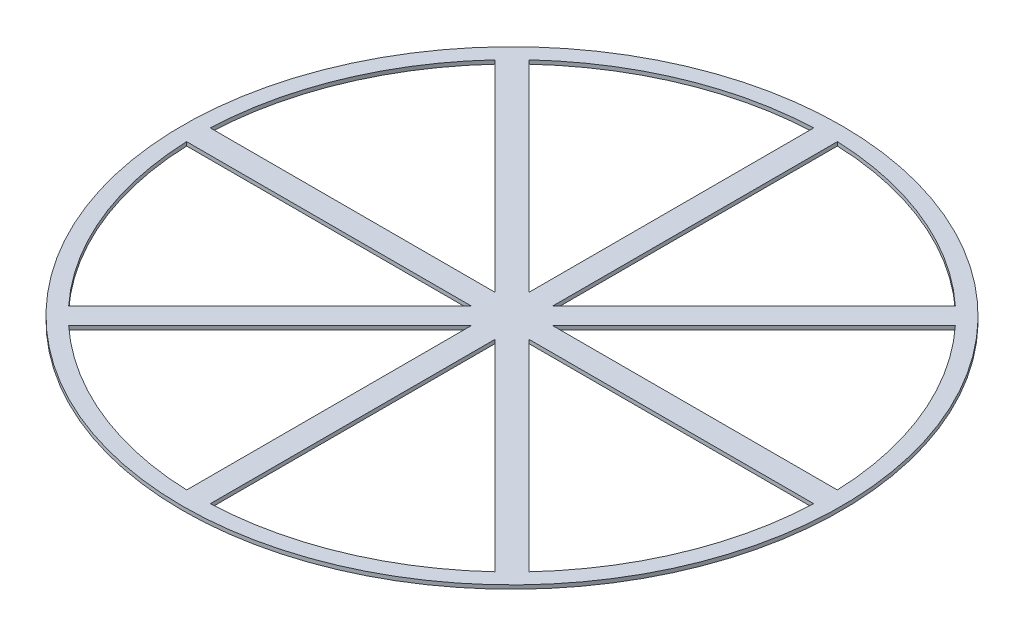
from build123d import *

# Parameters (mm, degrees)
SKETCH1_R           = 132.334
BOSS_EXTRUDE1_DEPTH = 1.524


with BuildPart() as part:
    # Sketch1 → Boss-Extrude1 (new body)
    with BuildSketch(Plane(origin=(0, 0, 0), x_dir=(1, 0, 0), z_dir=(0, 1, 0))):
        with Locations(Location((0, 0, 0), (0, 0, 90))):
            Circle(SKETCH1_R)
        with BuildLine():
            ThreePointArc((-92.388062371, 85.65287028), (-116.394039024, 48.211989543), (-125.893950807, 4.7625))
            Line((-125.893950807, 4.7625), (-11.497692091, 4.7625))
            Line((-11.497692091, 4.7625), (-92.388062371, 85.65287028))
        make_face(mode=Mode.SUBTRACT)
        with BuildLine():
            ThreePointArc((-125.893950807, -4.7625), (-116.394039024, -48.211989543), (-92.388062371, -85.65287028))
            Line((-92.388062371, -85.65287028), (-11.497692091, -4.7625))
            Line((-11.497692091, -4.7625), (-125.893950807, -4.7625))
        make_face(mode=Mode.SUBTRACT)
        with BuildLine():
            ThreePointArc((-85.65287028, -92.388062371), (-48.211989543, -116.394039024), (-4.7625, -125.893950807))
            Line((-4.7625, -125.893950807), (-4.7625, -11.497692091))
            Line((-4.7625, -11.497692091), (-85.65287028, -92.388062371))
        make_face(mode=Mode.SUBTRACT)
        with BuildLine():
            ThreePointArc((4.7625, -125.893950807), (48.211989543, -116.394039024), (85.65287028, -92.388062371))
            Line((85.65287028, -92.388062371), (4.7625, -11.497692091))
            Line((4.7625, -11.497692091), (4.7625, -125.893950807))
        make_face(mode=Mode.SUBTRACT)
        with BuildLine():
            ThreePointArc((92.388062371, -85.65287028), (116.394039024, -48.211989543), (125.893950807, -4.7625))
            Line((125.893950807, -4.7625), (11.497692091, -4.7625))
            Line((11.497692091, -4.7625), (92.388062371, -85.65287028))
        make_face(mode=Mode.SUBTRACT)
        with BuildLine():
            ThreePointArc((125.893950807, 4.7625), (116.394039024, 48.211989543), (92.388062371, 85.65287028))
            Line((92.388062371, 85.65287028), (11.497692091, 4.7625))
            Line((11.497692091, 4.7625), (125.893950807, 4.7625))
        make_face(mode=Mode.SUBTRACT)
        with BuildLine():
            ThreePointArc((85.65287028, 92.388062371), (48.211989543, 116.394039024), (4.7625, 125.893950807))
            Line((4.7625, 125.893950807), (4.7625, 11.497692091))
            Line((4.7625, 11.497692091), (85.65287028, 92.388062371))
        make_face(mode=Mode.SUBTRACT)
        with BuildLine():
            ThreePointArc((-4.7625, 125.893950807), (-48.211989543, 116.394039024), (-85.65287028, 92.388062371))
            Line((-85.65287028, 92.388062371), (-4.7625, 11.497692091))
            Line((-4.7625, 11.497692091), (-4.7625, 125.893950807))
        make_face(mode=Mode.SUBTRACT)
    extrude(amount=BOSS_EXTRUDE1_DEPTH)


solid = part.part
